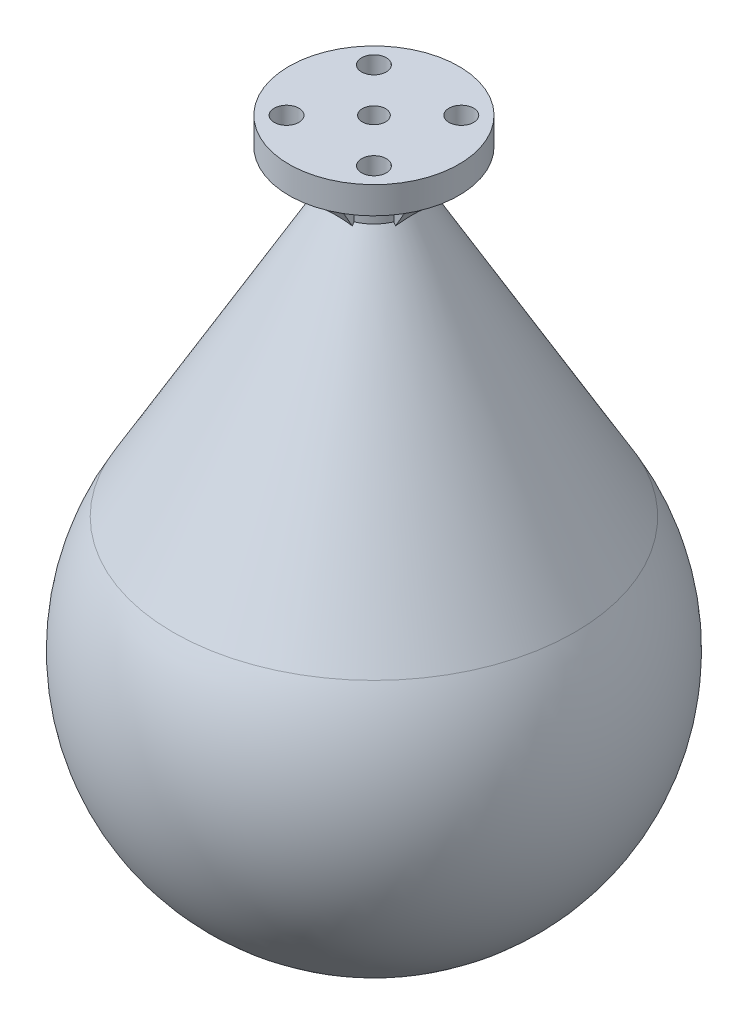
from build123d import *

# Parameters (mm, degrees)
CUT_EXTRUDE_1_REACH      = 101.499
SKETCH_3_R               = 1.6
EXTRUDE_1_DEPTH          = 2
PATTERN_CIRCULAR_1_COUNT = 4


with BuildPart() as part:
    # 草图2 → 旋转1 (revolve)
    with BuildSketch(Plane.XY):
        with BuildLine():
            Line((5, 51.339745962), (25.980762114, 15))
            ThreePointArc((25.980762114, 15), (25.980762114, -15), (0, -30))
            Line((0, -30), (0, -26.5))
            ThreePointArc((0, -26.5), (22.9496732, -13.25), (22.9496732, 13.25))
            Line((22.9496732, 13.25), (1.968911087, 49.589745962))
            Line((1.968911087, 49.589745962), (1.5, 50.401923789))
            Line((1.5, 50.401923789), (1.5, 60))
            Line((1.5, 60), (11, 60))
            Line((11, 60), (11, 56.5))
            Line((11, 56.5), (5, 56.5))
            Line((5, 56.5), (5, 51.339745962))
        make_face()
    revolve(axis=Axis((0, -26.5, 0), (0, -1, 0)))

    # 草图3 → 切除-拉伸1 (cut, up to next)
    with BuildSketch(Plane(origin=(0, 60, 0), x_dir=(1, 0, 0), z_dir=(0, 1, 0)), mode=Mode.PRIVATE) as cut_extrude_1_sk1:
        with Locations((-5.656854249, 5.656854249)):
            Circle(SKETCH_3_R)
    cut_extrude_1_tool1 = extrude(cut_extrude_1_sk1.sketch, amount=-CUT_EXTRUDE_1_REACH, mode=Mode.PRIVATE) & part.part
    # 草图3 → 切除-拉伸1 (cut, up to next)
    with BuildSketch(Plane(origin=(0, 60, 0), x_dir=(1, 0, 0), z_dir=(0, 1, 0)), mode=Mode.PRIVATE) as cut_extrude_1_sk2:
        with Locations((5.656854249, 5.656854249)):
            Circle(SKETCH_3_R)
    cut_extrude_1_tool2 = extrude(cut_extrude_1_sk2.sketch, amount=-CUT_EXTRUDE_1_REACH, mode=Mode.PRIVATE) & part.part
    # 草图3 → 切除-拉伸1 (cut, up to next)
    with BuildSketch(Plane(origin=(0, 60, 0), x_dir=(1, 0, 0), z_dir=(0, 1, 0)), mode=Mode.PRIVATE) as cut_extrude_1_sk3:
        with Locations((5.656854249, -5.656854249)):
            Circle(SKETCH_3_R)
    cut_extrude_1_tool3 = extrude(cut_extrude_1_sk3.sketch, amount=-CUT_EXTRUDE_1_REACH, mode=Mode.PRIVATE) & part.part
    # 草图3 → 切除-拉伸1 (cut, up to next)
    with BuildSketch(Plane(origin=(0, 60, 0), x_dir=(1, 0, 0), z_dir=(0, 1, 0)), mode=Mode.PRIVATE) as cut_extrude_1_sk4:
        with Locations((-5.656854249, -5.656854249)):
            Circle(SKETCH_3_R)
    cut_extrude_1_tool4 = extrude(cut_extrude_1_sk4.sketch, amount=-CUT_EXTRUDE_1_REACH, mode=Mode.PRIVATE) & part.part
    add(cut_extrude_1_tool1.solids().sort_by_distance((-5.656854, 60, -5.656854))[0], mode=Mode.SUBTRACT)
    add(cut_extrude_1_tool2.solids().sort_by_distance((5.656854, 60, -5.656854))[0], mode=Mode.SUBTRACT)
    add(cut_extrude_1_tool3.solids().sort_by_distance((5.656854, 60, 5.656854))[0], mode=Mode.SUBTRACT)
    add(cut_extrude_1_tool4.solids().sort_by_distance((-5.656854, 60, 5.656854))[0], mode=Mode.SUBTRACT)

    # 草图4 → 凸台-拉伸1 (add, symmetric)
    with BuildSketch(Plane.XY):
        Polygon((-5, 51.339745962), (-7.979274058, 56.5), (-8.520148677, 57.436822322), (-4.121868793, 57.436822322), (-4.121868793, 49.818778096), align=None)
    extrude_1 = extrude(amount=EXTRUDE_1_DEPTH, both=True)

    # 阵列(圆周)1: 凸台-拉伸1 ×4 about axis
    pattern_circular_1_axis = Axis((0, 60, 0), (0, 1, 0))
    for i in range(1, PATTERN_CIRCULAR_1_COUNT):
        add(extrude_1.rotate(pattern_circular_1_axis, i * 360 / PATTERN_CIRCULAR_1_COUNT))


solid = part.part
